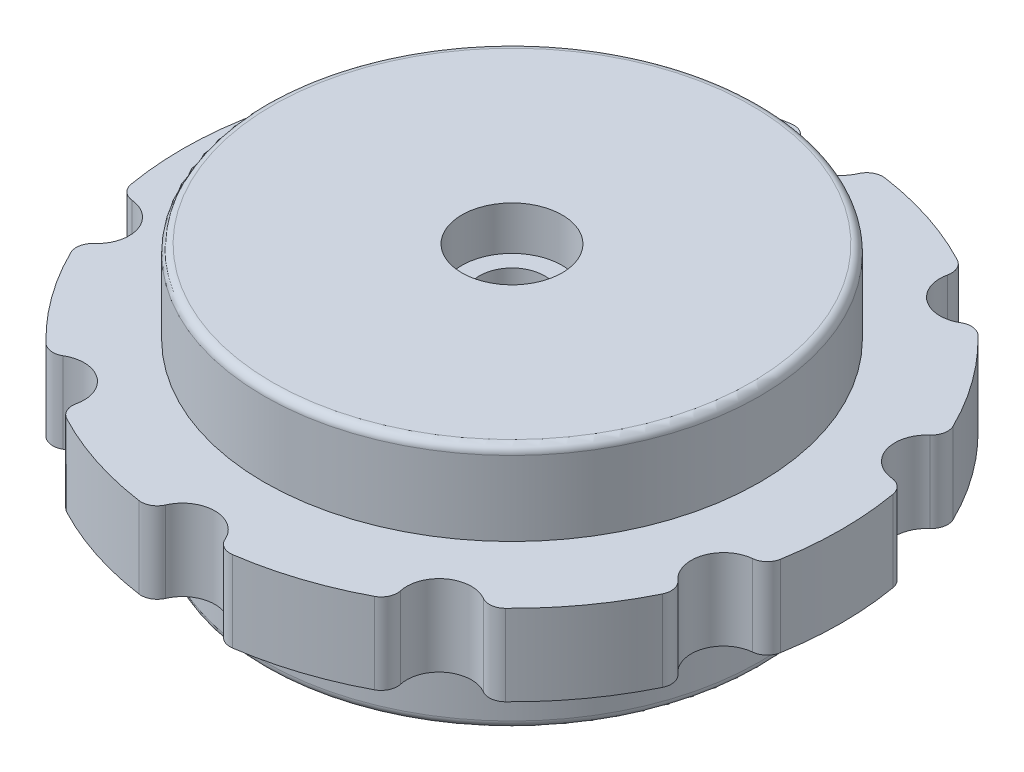
from build123d import *

# Parameters (mm, degrees)
SKETCH_1_R                       = 15.3
SKETCH_1_R_2                     = 13.7
EXTRUDE_1_DEPTH                  = 7.6
SKETCH_1_3_R                     = 20.35
EXTRUDE_2_DEPTH                  = 2.5
SKETCH_1_4_R                     = 2
CUT_EXTRUDE_1_DEPTH              = 30.765836121
FILLET_1_R                       = 1
PATTERN_CIRCULAR_1_COUNT         = 10
FILLET_1_OF_PATTERN_CIRCULAR_1_R = 1
FILLET_2_R                       = 0.5
SKETCH_1_5_R                     = 13.7
EXTRUDE_3_DEPTH                  = 3.9
EXTRUDE_START                    = -7.6
SKETCH_1_6_R                     = 13.7
EXTRUDE_5_DEPTH                  = 15.2
SKETCH_4_R                       = 2
CUT_EXTRUDE_3_DEPTH              = 33.42412133
SKETCH_4_3_R                     = 3.1
CUT_EXTRUDE_4_DEPTH              = 2.7
CUT_EXTRUDE_START                = -12.5
SKETCH_4_4_R                     = 3.1
CUT_EXTRUDE_5_DEPTH              = 2.7
SKETCH_5_R                       = 13
CUT_EXTRUDE_6_DEPTH              = 4.5
SKETCH_6_R                       = 3.1
CUT_EXTRUDE_7_DEPTH              = 4.6
SKETCH_7_R                       = 0.75
CUT_EXTRUDE_8_DEPTH              = 5


with BuildPart() as part:
    # 草图1 → 凸台-拉伸1 (new, symmetric)
    with BuildSketch(Plane(origin=(0, 0, 0), x_dir=(1, 0, 0), z_dir=(0, 1, 0))):
        with Locations(Location((0, 0, 0), (0, 0, 90))):
            Circle(SKETCH_1_R)
        with Locations(Location((0, 0, 0), (0, 0, 90))):
            Circle(SKETCH_1_R_2, mode=Mode.SUBTRACT)
    extrude(amount=EXTRUDE_1_DEPTH, both=True)

    # 草图1<3> → 凸台-拉伸2 (add, symmetric)
    with BuildSketch(Plane(origin=(0, 0, 0), x_dir=(1, 0, 0), z_dir=(0, 1, 0))):
        with Locations(Location((0, 0, 0), (0, 0, 270))):
            Circle(SKETCH_1_3_R)
    extrude(amount=EXTRUDE_2_DEPTH, both=True)

    # 草图1<4> → 切除-拉伸1 (cut, symmetric)
    with BuildSketch(Plane(origin=(0, 0, 0), x_dir=(1, 0, 0), z_dir=(0, 1, 0))):
        with Locations((0, 20.35)):
            Circle(SKETCH_1_4_R)
    cut_extrude_1 = extrude(amount=CUT_EXTRUDE_1_DEPTH, both=True, mode=Mode.SUBTRACT)

    # 圆角1
    fillet_1_edges = [part.edges().sort_by_distance(p)[0] for p in [
        (-1.997583796, 0, -20.251719902),
        (1.997583796, 0, -20.251719902),
    ]]
    fillet(fillet_1_edges, radius=FILLET_1_R)

    # 阵列(圆周)1: 切除-拉伸1 ×10 about axis
    pattern_circular_1_axis = Axis((0, 0, 0), (0, 1, 0))
    for i in range(1, PATTERN_CIRCULAR_1_COUNT):
        add(cut_extrude_1.rotate(pattern_circular_1_axis, i * 360 / PATTERN_CIRCULAR_1_COUNT), mode=Mode.SUBTRACT)

    # 圆角1 of 阵列(圆周)1
    fillet_1_of_pattern_circular_1_edges = [part.edges().sort_by_distance(p)[0] for p in [
        (-13.51974153, 0, -15.20983527),
        (-10.287583053, 0, -17.558135861),
        (-19.877817519, 0, -4.358310529),
        (-18.643242838, 0, -8.157940701),
        (-18.643242838, 0, 8.157940701),
        (-19.877817519, 0, 4.358310529),
        (-10.287583053, 0, 17.558135861),
        (-13.51974153, 0, 15.20983527),
        (1.997583796, 0, 20.251719902),
        (-1.997583796, 0, 20.251719902),
        (13.51974153, 0, 15.20983527),
        (10.287583053, 0, 17.558135861),
        (19.877817519, 0, 4.358310529),
        (18.643242838, 0, 8.157940701),
        (18.643242838, 0, -8.157940701),
        (19.877817519, 0, -4.358310529),
        (10.287583053, 0, -17.558135861),
        (13.51974153, 0, -15.20983527),
    ]]
    fillet(fillet_1_of_pattern_circular_1_edges, radius=FILLET_1_OF_PATTERN_CIRCULAR_1_R)

    # 圆角2
    fillet_2_edges = [part.edges().sort_by_distance(p)[0] for p in [
        (0, -7.6, 15.3),
        (0, 7.6, 15.3),
    ]]
    fillet(fillet_2_edges, radius=FILLET_2_R)

    # 草图1<5> → 凸台-拉伸3 (add, symmetric)
    with BuildSketch(Plane(origin=(0, 0, 0), x_dir=(1, 0, 0), z_dir=(0, 1, 0))):
        with Locations(Location((0, 0, 0), (0, 0, 90))):
            Circle(SKETCH_1_5_R)
    extrude(amount=EXTRUDE_3_DEPTH, both=True)

    # 草图1<6> → 凸台-拉伸5 (add)
    with BuildSketch(Plane(origin=(0, 0, 0), x_dir=(1, 0, 0), z_dir=(0, 1, 0)).offset(EXTRUDE_START)):
        Circle(SKETCH_1_6_R)
    extrude(amount=EXTRUDE_5_DEPTH)

    # 草图4 → 切除-拉伸3 (cut, through all)
    with BuildSketch(Plane.XZ.offset(7.6)):
        with Locations(Location((0, 0, 0), (0, 0, 270))):
            Circle(SKETCH_4_R)
    extrude(amount=-CUT_EXTRUDE_3_DEPTH, mode=Mode.SUBTRACT)

    # 草图4<3> → 切除-拉伸4 (cut)
    with BuildSketch(Plane.XZ.offset(7.6)):
        with Locations(Location((0, 0, 0), (0, 0, 270))):
            Circle(SKETCH_4_3_R)
    extrude(amount=-CUT_EXTRUDE_4_DEPTH, mode=Mode.SUBTRACT)

    # 草图4<4> → 切除-拉伸5 (cut)
    with BuildSketch(Plane.XZ.offset(7.6).offset(CUT_EXTRUDE_START)):
        with Locations(Location((0, 0, 0), (0, 0, 270))):
            Circle(SKETCH_4_4_R)
    extrude(amount=-CUT_EXTRUDE_5_DEPTH, mode=Mode.SUBTRACT)

    # 草图5 → 切除-拉伸6 (cut)
    with BuildSketch(Plane.XZ.offset(7.6)):
        with Locations(Location((0, 0, 0), (0, 0, 270))):
            Circle(SKETCH_5_R)
    extrude(amount=-CUT_EXTRUDE_6_DEPTH, mode=Mode.SUBTRACT)

    # 草图6 → 切除-拉伸7 (cut)
    with BuildSketch(Plane.XZ.offset(3.1)):
        with Locations(Location((0, 0, 0), (0, 0, 90))):
            Circle(SKETCH_6_R)
    extrude(amount=-CUT_EXTRUDE_7_DEPTH, mode=Mode.SUBTRACT)

    # 草图7 → 切除-拉伸8 (cut)
    with BuildSketch(Plane.XZ.offset(3.1)):
        with Locations(Location((-8, 0, 0), (0, 0, 270))):
            Circle(SKETCH_7_R)
        with Locations(Location((4, 6.92820323, 0), (0, 0, 270))):
            Circle(SKETCH_7_R)
        with Locations(Location((4, -6.92820323, 0), (0, 0, 270))):
            Circle(SKETCH_7_R)
    extrude(amount=-CUT_EXTRUDE_8_DEPTH, mode=Mode.SUBTRACT)


solid = part.part
